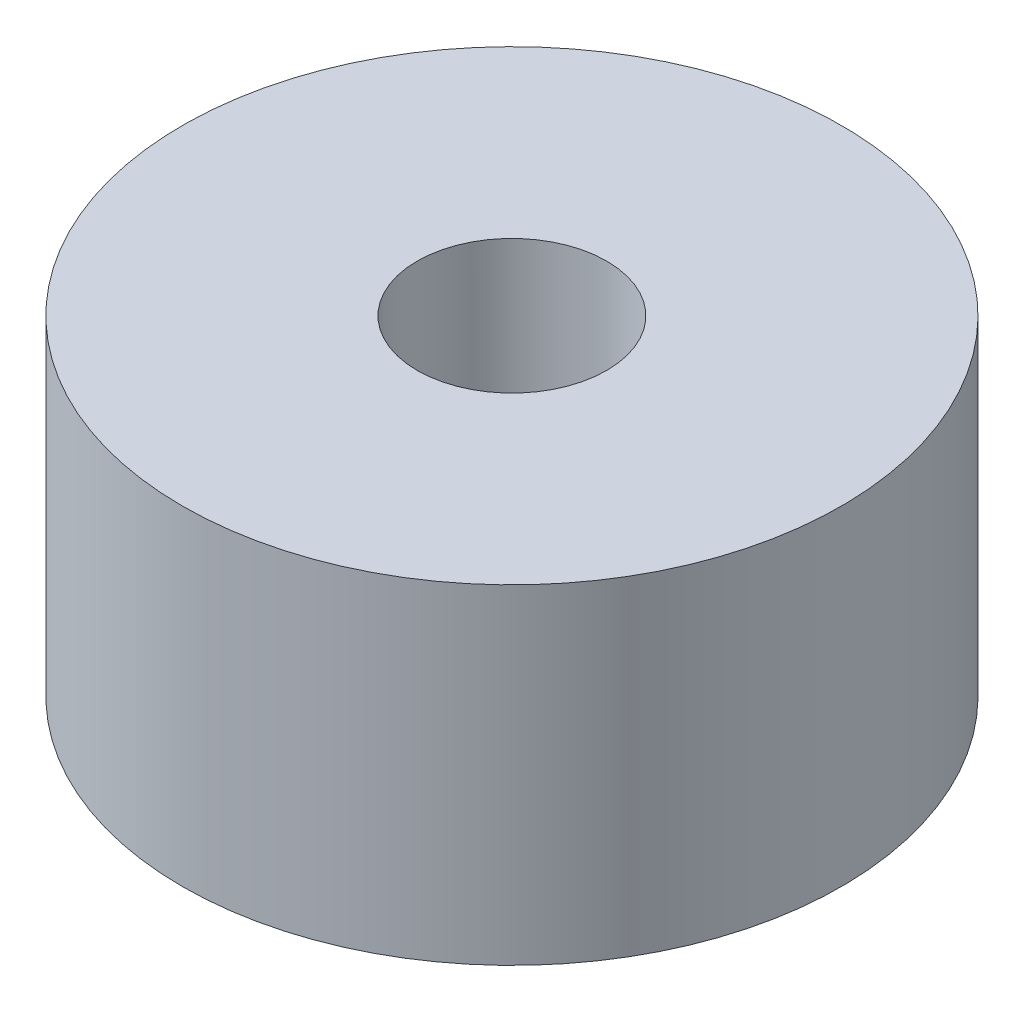
from build123d import *

# Parameters (mm, degrees)
SKETCH3_R           = 12
BOSS_EXTRUDE1_DEPTH = 12
SKETCH2_W           = 17.2
SKETCH2_H           = 11
CUT_EXTRUDE1_DEPTH  = 2.2
SKETCH4_R           = 3.45
CUT_EXTRUDE2_DEPTH  = 21.784609691
SKETCH5_W           = 1.698676218
SKETCH5_H           = 2.5
CUT_EXTRUDE3_DEPTH  = 2.5
FILLET1_R           = 0.5


with BuildPart() as part:
    # Sketch3 → Boss-Extrude1 (new body)
    with BuildSketch(Plane(origin=(0, 0, 0), x_dir=(1, 0, 0), z_dir=(0, 1, 0))):
        with Locations(Location((0, 0, 0), (0, 0, 270))):
            Circle(SKETCH3_R)
    extrude(amount=BOSS_EXTRUDE1_DEPTH)

    # Sketch2 → Cut-Extrude1 (cut)
    with BuildSketch(Plane(origin=(0, 0, 0), x_dir=(1, 0, 0), z_dir=(0, 1, 0))):
        Rectangle(SKETCH2_W, SKETCH2_H)
    extrude(amount=CUT_EXTRUDE1_DEPTH, mode=Mode.SUBTRACT)

    # Sketch4 → Cut-Extrude2 (cut, through all)
    with BuildSketch(Plane(origin=(0, 0, 0), x_dir=(1, 0, 0), z_dir=(0, 1, 0))):
        with Locations(Location((0, 0, 0), (0, 0, 90))):
            Circle(SKETCH4_R)
    extrude(amount=CUT_EXTRUDE2_DEPTH, mode=Mode.SUBTRACT)

    # Sketch5 → Cut-Extrude3 (cut)
    with BuildSketch(Plane.XZ.offset(-2.2)):
        with Locations((-7.750661891, 0)):
            Rectangle(SKETCH5_W, SKETCH5_H)
    extrude(amount=-CUT_EXTRUDE3_DEPTH, mode=Mode.SUBTRACT)

    # Fillet1
    fillet1_edges = [part.edges().sort_by_distance(p)[0] for p in [
        (-7.750661891, 2.2, -1.25),
        (-6.901323782, 2.2, 0),
        (-7.750661891, 2.2, 1.25),
    ]]
    fillet(fillet1_edges, radius=FILLET1_R)


solid = part.part
